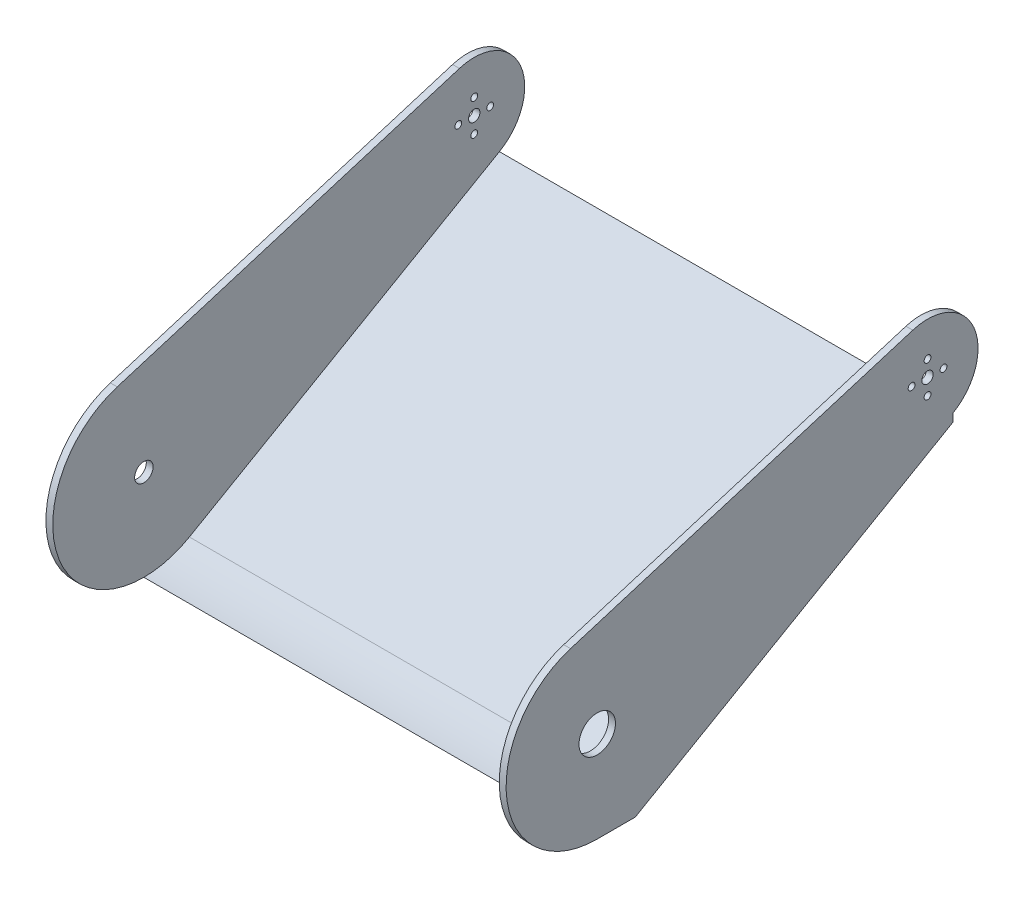
from build123d import *

# Parameters (mm, degrees)
SKETCH_2_R          = 3
SKETCH_2_R_2        = 1.5
SKETCH_2_R_3        = 2.5
EXTRUDE_1_DEPTH     = 3
EXTRUDE_2_DEPTH     = 196
SKETCH_5_R          = 8
CUT_EXTRUDE_1_DEPTH = 10
SKETCH_6_R          = 4.05
CUT_EXTRUDE_2_DEPTH = 10


with BuildPart() as part:
    # 草图2 → 凸台-拉伸1 (new body)
    with BuildSketch(Plane(origin=(0, 0, 0), x_dir=(0, 0, -1), z_dir=(1, 0, 0))):
        with BuildLine():
            Line((138.514809283, 84.200667909), (-11.70063651, 38.25042621))
            ThreePointArc((-11.70063651, 38.25042621), (-39.560188627, -5.915359313), (0, -40))
            Line((0, -40), (16.710190716, -40))
            Line((16.710190716, -40), (156.071648789, 40.329376559))
            Line((156.071648789, 40.329376559), (156.071648789, 43.792069046))
            ThreePointArc((156.071648789, 43.792069046), (165.334026038, 71.834783727), (138.514809283, 84.200667909))
        make_face()
        Circle(SKETCH_2_R, mode=Mode.SUBTRACT)
        with Locations((145, 70)):
            Circle(SKETCH_2_R_2, mode=Mode.SUBTRACT)
        with Locations((138, 63)):
            Circle(SKETCH_2_R_2, mode=Mode.SUBTRACT)
        with Locations((145, 56)):
            Circle(SKETCH_2_R_2, mode=Mode.SUBTRACT)
        with Locations((145, 63)):
            Circle(SKETCH_2_R_3, mode=Mode.SUBTRACT)
        with Locations((152, 63)):
            Circle(SKETCH_2_R_2, mode=Mode.SUBTRACT)
    extrude_1 = extrude(amount=EXTRUDE_1_DEPTH)

    # 草图4 → 凸台-拉伸2 (add)
    with BuildSketch(Plane(origin=(3, 0, 0), x_dir=(0, 0, -1), z_dir=(1, 0, 0))):
        with BuildLine():
            Line((0, -40), (16.710190716, -40))
            Line((16.710190716, -40), (156.071648789, 40.329376559))
            Line((156.071648789, 40.329376559), (156.071648789, 43.792069046))
            Line((156.071648789, 43.792069046), (19.975563357, -34.655113166))
            ThreePointArc((19.975563357, -34.655113166), (10.339136167, -38.640681455), (0, -40))
        make_face()
    extrude(amount=EXTRUDE_2_DEPTH)

    # 镜向2: 凸台-拉伸1 across plane
    add(extrude_1.mirror(Plane(origin=(101, 0, 0), x_dir=(0, 0, 1), z_dir=(1, 0, 0))))

    # 草图5 → 切除-拉伸1 (cut)
    with BuildSketch(Plane(origin=(202, 0, 0), x_dir=(0, 0, -1), z_dir=(1, 0, 0))):
        Circle(SKETCH_5_R)
    extrude(amount=-CUT_EXTRUDE_1_DEPTH, mode=Mode.SUBTRACT)

    # 草图6 → 切除-拉伸2 (cut)
    with BuildSketch(Plane.ZY):
        Circle(SKETCH_6_R)
    extrude(amount=-CUT_EXTRUDE_2_DEPTH, mode=Mode.SUBTRACT)


solid = part.part
